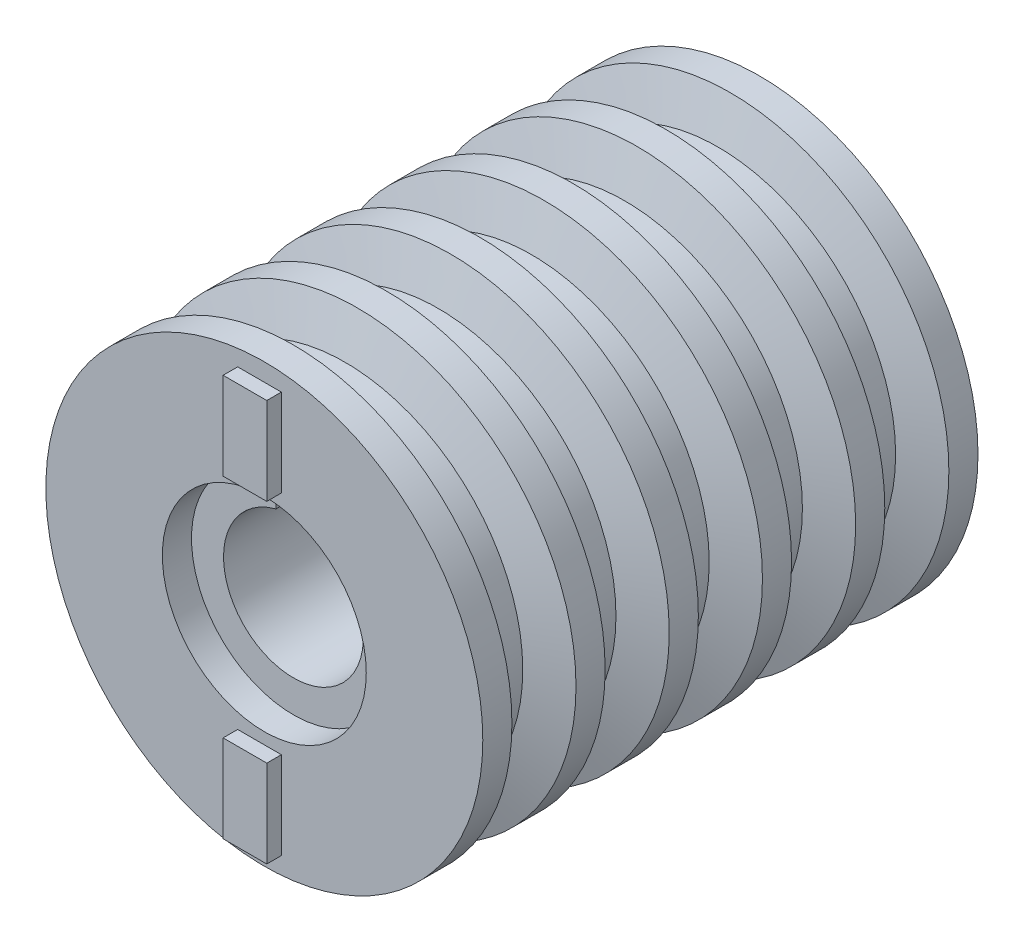
from build123d import *

# Parameters (mm, degrees)
SKETCH1_R           = 75
SKETCH1_R_2         = 24
BOSS_EXTRUDE1_DEPTH = 85
SKETCH3_W           = 12
SKETCH3_H           = 6
CUT_EXTRUDE1_DEPTH  = 201.374649095
SKETCH4_R           = 35
SKETCH4_R_2         = 20
CUT_EXTRUDE2_DEPTH  = 10
SKETCH5_W           = 15
SKETCH5_H           = 30
BOSS_EXTRUDE2_DEPTH = 5


with BuildPart() as part:
    # Sketch1 → Boss-Extrude1 (new, symmetric)
    with BuildSketch(Plane.XY):
        Circle(SKETCH1_R)
        Circle(SKETCH1_R_2, mode=Mode.SUBTRACT)
    extrude(amount=BOSS_EXTRUDE1_DEPTH, both=True)

    # Sketch2 → Cut-Revolve1 (revolve, cut)
    with BuildSketch(Plane(origin=(0, 0, 0), x_dir=(1, 0, 0), z_dir=(0, 1, 0))):
        Polygon((75, 75), (61, 70.71977046), (61, 57.28022954), (75, 53), align=None)
        Polygon((75, 43), (75, 21), (61, 25.28022954), (61, 38.71977046), align=None)
        Polygon((75, -21), (75, -43), (61, -38.71977046), (61, -25.28022954), align=None)
        Polygon((75, 11), (61, 6.71977046), (61, -6.71977046), (75, -11), align=None)
        Polygon((75, -75), (75, -53), (61, -57.28022954), (61, -70.71977046), align=None)
    revolve(axis=Axis((0, 0, 0), (0, 0, -1)), mode=Mode.SUBTRACT)

    # Sketch3 → Cut-Extrude1 (cut, through all)
    with BuildSketch(Plane.XY.offset(85)):
        with Locations((0, 24)):
            Rectangle(SKETCH3_W, SKETCH3_H)
    extrude(amount=-CUT_EXTRUDE1_DEPTH, mode=Mode.SUBTRACT)

    # Sketch4 → Cut-Extrude2 (cut)
    with BuildSketch(Plane.XY.offset(85)):
        Circle(SKETCH4_R)
        Circle(SKETCH4_R_2, mode=Mode.SUBTRACT)
    cut_extrude2 = extrude(amount=-CUT_EXTRUDE2_DEPTH, mode=Mode.SUBTRACT)

    # Mirror1: Cut-Extrude2 across plane
    add(cut_extrude2.mirror(Plane.XY), mode=Mode.SUBTRACT)

    # Sketch5 → Boss-Extrude2 (add)
    with BuildSketch(Plane.XY.offset(85)):
        with Locations((-1.649481041, 53.900577931)):
            Rectangle(SKETCH5_W, SKETCH5_H)
        with Locations((-1.649481041, -53.900577931)):
            Rectangle(SKETCH5_W, SKETCH5_H)
    extrude(amount=BOSS_EXTRUDE2_DEPTH)


solid = part.part
